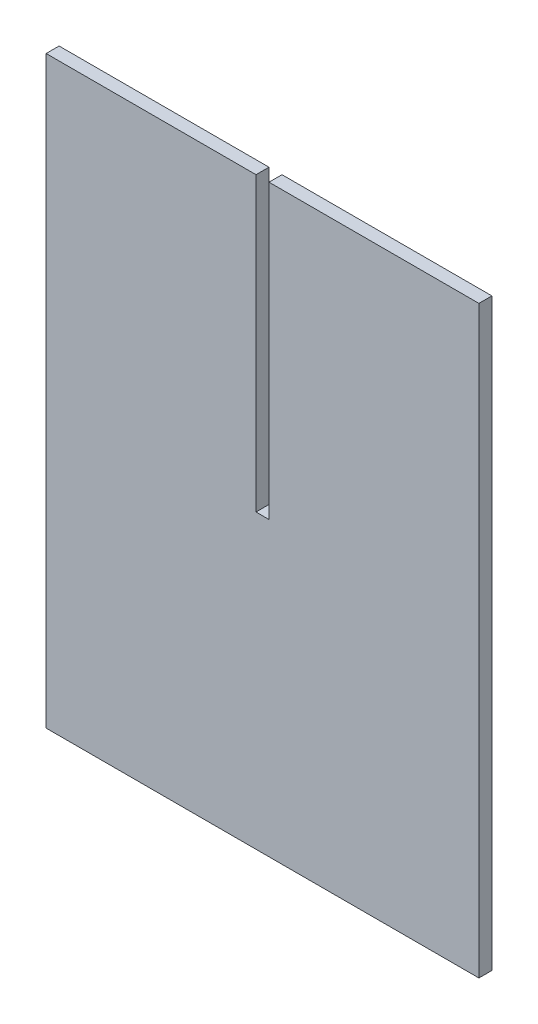
from build123d import *

# Parameters (mm, degrees)
SKETCH1_W           = 100
SKETCH1_H           = 135
BOSS_EXTRUDE1_DEPTH = 3
SKETCH2_W           = 3
SKETCH2_H           = 67.5
CUT_EXTRUDE1_DEPTH  = 3


with BuildPart() as part:
    # Sketch1 → Boss-Extrude1 (new body)
    with BuildSketch(Plane.XY):
        Rectangle(SKETCH1_W, SKETCH1_H)
    extrude(amount=BOSS_EXTRUDE1_DEPTH)

    # Sketch2 → Cut-Extrude1 (cut)
    with BuildSketch(Plane.XY.offset(3)):
        with Locations((0, 33.75)):
            Rectangle(SKETCH2_W, SKETCH2_H)
    extrude(amount=-CUT_EXTRUDE1_DEPTH, mode=Mode.SUBTRACT)


solid = part.part
